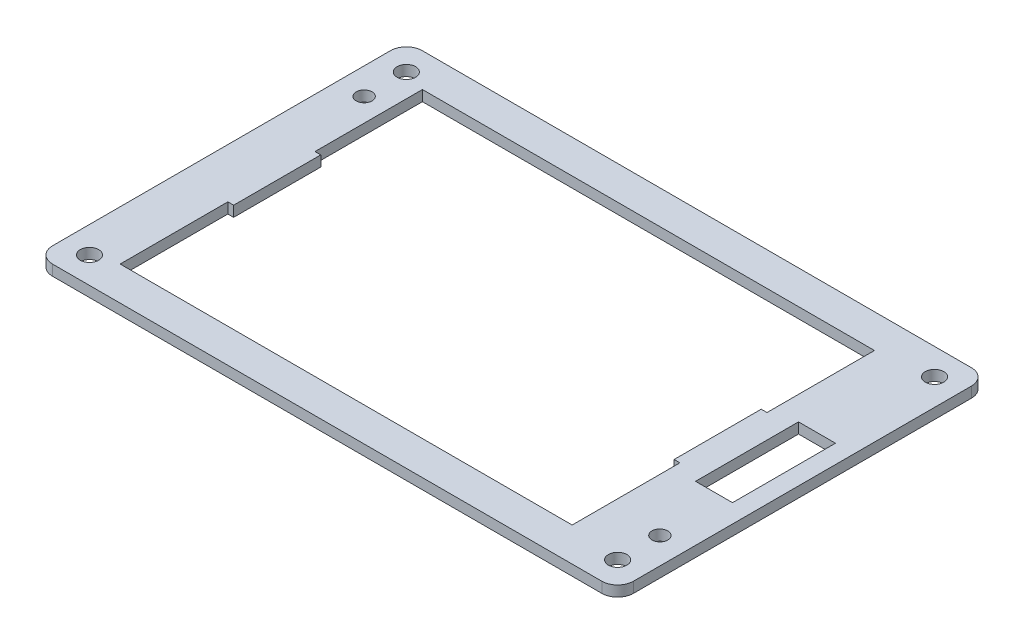
from build123d import *

# Parameters (mm, degrees)
SKETCH1_W           = 110
SKETCH1_H           = 70
SKETCH1_R           = 1.75
BOSS_EXTRUDE1_DEPTH = 2
SKETCH2_W           = 7
SKETCH2_H           = 19.5
CUT_EXTRUDE1_DEPTH  = 66.222695436
FILLET1_R           = 3
SKETCH3_R           = 1.5
CUT_EXTRUDE2_DEPTH  = 66.222695436


with BuildPart() as part:
    # Sketch1 → Boss-Extrude1 (new body)
    with BuildSketch(Plane(origin=(0, 0, 0), x_dir=(1, 0, 0), z_dir=(0, 1, 0))):
        Rectangle(SKETCH1_W, SKETCH1_H)
        with Locations(Location((-50, 30, 0), (0, 0, 270))):
            Circle(SKETCH1_R, mode=Mode.SUBTRACT)
        with Locations(Location((-50, -30, 0), (0, 0, 270))):
            Circle(SKETCH1_R, mode=Mode.SUBTRACT)
        with Locations(Location((50, -30, 0), (0, 0, 270))):
            Circle(SKETCH1_R, mode=Mode.SUBTRACT)
        with Locations(Location((50, 30, 0), (0, 0, 270))):
            Circle(SKETCH1_R, mode=Mode.SUBTRACT)
        Polygon((39.984778377, 28.64285469), (-45.603033207, 28.64285469), (-45.603033207, 8.299784998), (-44.51, 8.299784998), (-44.51, -8.200215002), (-45.603033207, -8.200215002), (-45.603033207, -28.591287888), (39.984778377, -28.591287888), (39.984778377, -8.200215002), (38.89, -8.200215002), (38.89, 8.299784998), (39.984778377, 8.299784998), align=None, mode=Mode.SUBTRACT)
    extrude(amount=BOSS_EXTRUDE1_DEPTH)

    # Sketch2 → Cut-Extrude1 (cut, through all)
    with BuildSketch(Plane(origin=(0, 2, 0), x_dir=(1, 0, 0), z_dir=(0, 1, 0))):
        with Locations((48, 0)):
            Rectangle(SKETCH2_W, SKETCH2_H)
    extrude(amount=-CUT_EXTRUDE1_DEPTH, mode=Mode.SUBTRACT)

    # Fillet1
    fillet1_edges = [part.edges().sort_by_distance(p)[0] for p in [
        (-55, 1, -35),
        (55, 1, -35),
        (55, 1, 35),
        (-55, 1, 35),
    ]]
    fillet(fillet1_edges, radius=FILLET1_R)

    # Sketch3 → Cut-Extrude2 (cut, through all)
    with BuildSketch(Plane.XZ):
        with Locations(Location((50, 22, 0), (0, 0, 270))):
            Circle(SKETCH3_R)
        with Locations(Location((-50, -22, 0), (0, 0, 270))):
            Circle(SKETCH3_R)
    extrude(amount=-CUT_EXTRUDE2_DEPTH, mode=Mode.SUBTRACT)


solid = part.part
